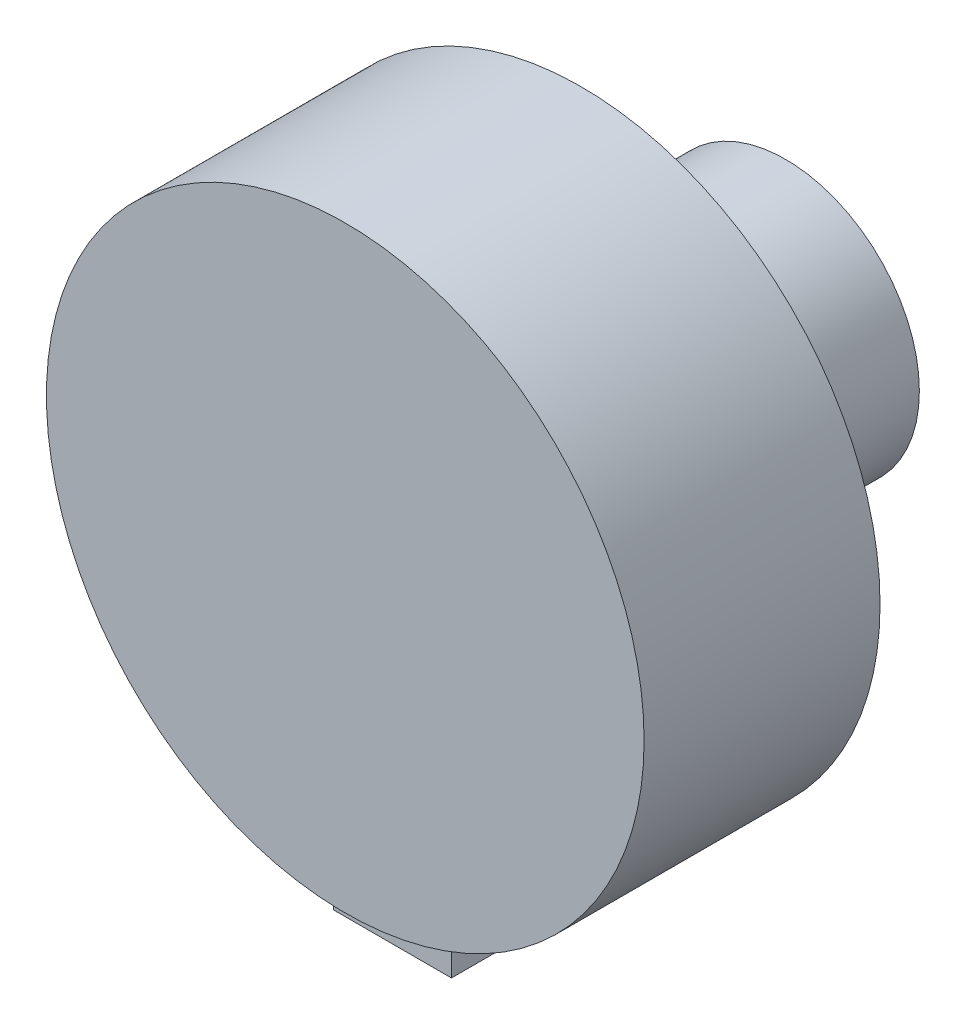
from build123d import *

# Parameters (mm, degrees)
SKETCH1_R           = 48.26
BOSS_EXTRUDE1_DEPTH = 38.1
SKETCH2_R           = 21.59
BOSS_EXTRUDE2_DEPTH = 33.02
SKETCH3_W           = 19.05
SKETCH3_H           = 22.86
BOSS_EXTRUDE3_DEPTH = 56.388


with BuildPart() as part:
    # Sketch1 → Boss-Extrude1 (new body)
    with BuildSketch(Plane.XY):
        with Locations(Location((0, 0, 0), (0, 0, 180))):
            Circle(SKETCH1_R)
    extrude(amount=BOSS_EXTRUDE1_DEPTH)

    # Sketch2 → Boss-Extrude2 (add)
    with BuildSketch(Plane(origin=(0, 0, 0), x_dir=(-1, 0, 0), z_dir=(0, 0, -1))):
        Circle(SKETCH2_R)
    extrude(amount=BOSS_EXTRUDE2_DEPTH)

    # Sketch3 → Boss-Extrude3 (add)
    with BuildSketch(Plane(origin=(0, 0, 0), x_dir=(1, 0, 0), z_dir=(0, 1, 0))):
        with Locations((0, -19.05)):
            Rectangle(SKETCH3_W, SKETCH3_H)
    extrude(amount=-BOSS_EXTRUDE3_DEPTH)


solid = part.part
